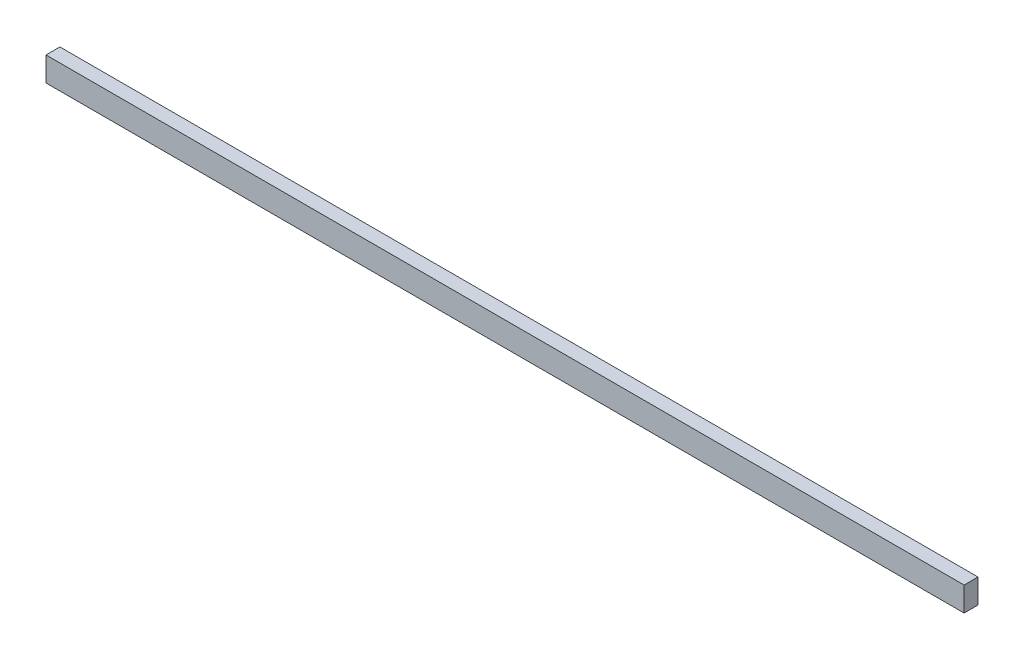
from build123d import *

# Parameters (mm, degrees)
SKETCH1_W           = 529
SKETCH1_H           = 8
BOSS_EXTRUDE1_DEPTH = 14
SKETCH2_R           = 2
CUT_EXTRUDE1_DEPTH  = 10


with BuildPart() as part:
    # Sketch1 → Boss-Extrude1 (new body)
    with BuildSketch(Plane(origin=(0, 0, 0), x_dir=(1, 0, 0), z_dir=(0, 1, 0))):
        with Locations((39.778516938, 1.822827571)):
            Rectangle(SKETCH1_W, SKETCH1_H)
    extrude(amount=BOSS_EXTRUDE1_DEPTH)

    # Sketch2 → Cut-Extrude1 (cut)
    with BuildSketch(Plane.XZ):
        with Locations(Location((-208.721483062, -1.822827571, 0), (0, 0, 270))):
            Circle(SKETCH2_R)
        with Locations(Location((288.278516938, -1.822827571, 0), (0, 0, 270))):
            Circle(SKETCH2_R)
    extrude(amount=-CUT_EXTRUDE1_DEPTH, mode=Mode.SUBTRACT)


solid = part.part
